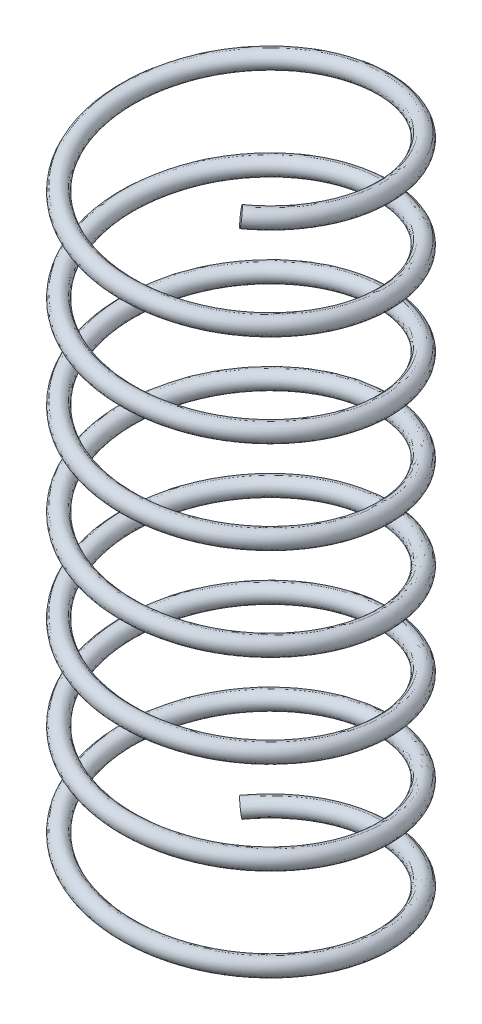
from build123d import *

# Parameters (mm, degrees)
SWEEP1_PITCH       = 2.8702
SWEEP1_HEIGHT      = 21.5265
SWEEP1_RADIUS      = 4.0005
SWEEP1_START_ANGLE = -135
SKETCH2_R          = 0.2667


with BuildPart() as part:
    # Sweep1: sweep along a helix
    with BuildLine() as sweep1_path:
        add(Helix(SWEEP1_PITCH, SWEEP1_HEIGHT, SWEEP1_RADIUS, center=(0, 0, 0), direction=(0, 1, 0), lefthand=True, mode=Mode.PRIVATE).rotate(Axis((0, 0, 0), (0, 1, 0)), SWEEP1_START_ANGLE))
    # Sketch2 → Sweep1 (sweep)
    with BuildSketch(Plane(origin=(2.828780678, 21.5265, 2.828780678), x_dir=(0.6935565690294935, -0.11199919581918819, 0.7116427936063798), z_dir=(-0.7025414822687001, 0.11345012729649293, 0.7025414822685615))):
        Circle(SKETCH2_R)
    sweep(path=sweep1_path.line, is_frenet=True)


solid = part.part
